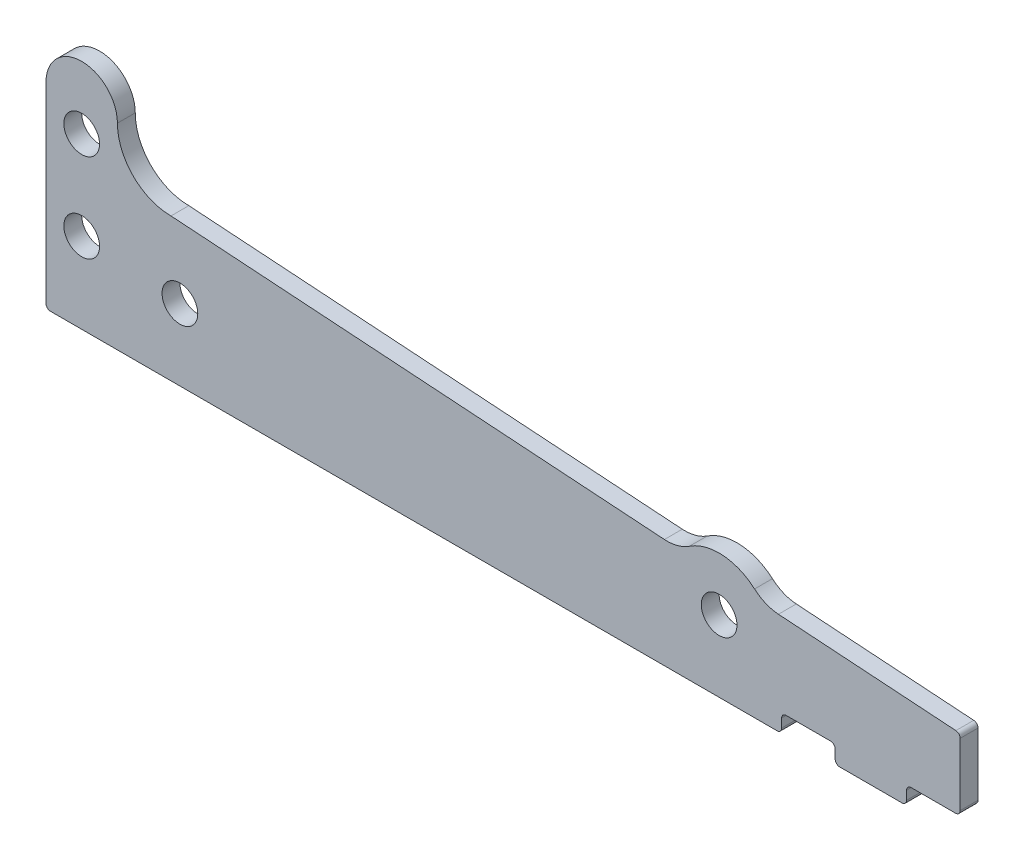
from build123d import *

# Parameters (mm, degrees)
SKETCH1_R           = 1.5875
BOSS_EXTRUDE1_DEPTH = 1.5875
FILLET1_R           = 0.4064
FILLET2_R           = 3.571875


with BuildPart() as part:
    # Sketch1 → Boss-Extrude1 (new body)
    with BuildSketch(Plane.XY):
        with BuildLine():
            Line((0, -1.5875), (65.4074384, -1.5875))
            Line((65.4074384, -1.5875), (65.4074384, 0))
            Line((65.4074384, 0), (70.1699384, 0))
            Line((70.1699384, 0), (70.1699384, -1.5875))
            Line((70.1699384, -1.5875), (76.5199384, -1.5875))
            Line((76.5199384, -1.5875), (76.5199384, 0))
            Line((76.5199384, 0), (81.2824384, 0))
            Line((81.2824384, 0), (81.2824384, 6.35))
            Line((81.2824384, 6.35), (63.718396184, 7.542088136))
            ThreePointArc((63.718396184, 7.542088136), (60.17368185, 9.514068607), (56.395022028, 8.039132457))
            Line((56.395022028, 8.039132457), (11.1125, 11.1125))
            ThreePointArc((11.1125, 11.1125), (7.744903955, 12.507403955), (6.35, 15.875))
            ThreePointArc((6.35, 15.875), (3.175, 19.05), (0, 15.875))
            Line((0, 15.875), (0, -1.5875))
        make_face()
        with Locations((3.175, 5.588)):
            Circle(SKETCH1_R, mode=Mode.SUBTRACT)
        with Locations((3.175, 13.462)):
            Circle(SKETCH1_R, mode=Mode.SUBTRACT)
        with Locations((11.90625, 4.7625)):
            Circle(SKETCH1_R, mode=Mode.SUBTRACT)
        with Locations((59.8511884, 4.7625)):
            Circle(SKETCH1_R, mode=Mode.SUBTRACT)
    extrude(amount=BOSS_EXTRUDE1_DEPTH)

    # Fillet1
    fillet1_edges = [part.edges().sort_by_distance(p)[0] for p in [
        (81.2824384, 6.35, 0.79375),
        (81.2824384, 0, 0.79375),
        (76.5199384, 0, 0.79375),
        (76.5199384, -1.5875, 0.79375),
        (70.1699384, -1.5875, 0.79375),
        (70.1699384, 0, 0.79375),
        (65.4074384, 0, 0.79375),
        (65.4074384, -1.5875, 0.79375),
        (0, -1.5875, 0.79375),
    ]]
    fillet(fillet1_edges, radius=FILLET1_R)

    # Fillet2
    fillet2_edges = [part.edges().sort_by_distance(p)[0] for p in [
        (56.395022028, 8.039132457, 0.79375),
        (63.718396184, 7.542088136, 0.79375),
    ]]
    fillet(fillet2_edges, radius=FILLET2_R)


solid = part.part
